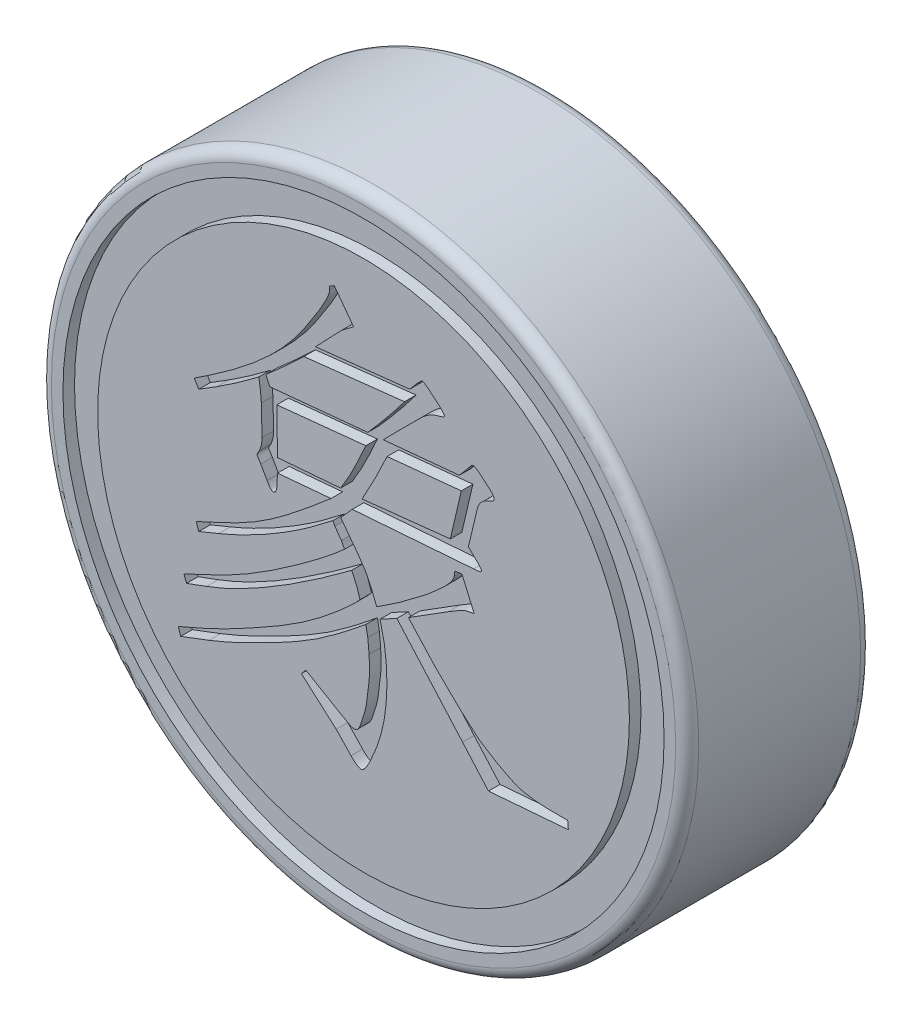
from build123d import *

# Parameters (mm, degrees)
SKETCH_1_R          = 14
EXTRUDE_1_DEPTH     = 8
SKETCH_2_R          = 13
SKETCH_2_R_2        = 11.5
CUT_EXTRUDE_1_DEPTH = 0.5
SKETCH_3_R          = 5.1
CUT_EXTRUDE_2_DEPTH = 5
CHAMFER_1_SIZE      = 0.5
FILLET_1_R          = 0.5
CUT_EXTRUDE_3_DEPTH = 0.5


with BuildPart() as part:
    # 草图1 → 凸台-拉伸1 (new body)
    with BuildSketch(Plane.XY):
        Circle(SKETCH_1_R)
    extrude(amount=EXTRUDE_1_DEPTH)

    # 草图2 → 切除-拉伸1 (cut)
    with BuildSketch(Plane.XY.offset(8)):
        Circle(SKETCH_2_R)
        Circle(SKETCH_2_R_2, mode=Mode.SUBTRACT)
    extrude(amount=-CUT_EXTRUDE_1_DEPTH, mode=Mode.SUBTRACT)

    # 草图3 → 切除-拉伸2 (cut)
    with BuildSketch(Plane(origin=(0, 0, 0), x_dir=(-1, 0, 0), z_dir=(0, 0, -1))):
        Circle(SKETCH_3_R)
    extrude(amount=-CUT_EXTRUDE_2_DEPTH, mode=Mode.SUBTRACT)

    # 倒角1
    chamfer_1_edges = [part.edges().sort_by_distance(p)[0] for p in [
        (5.1, 0, 0),
    ]]
    chamfer(chamfer_1_edges, length=CHAMFER_1_SIZE)

    # 圆角1
    fillet_1_edges = [part.edges().sort_by_distance(p)[0] for p in [
        (-14, 0, 0),
        (-14, 0, 8),
    ]]
    fillet(fillet_1_edges, radius=FILLET_1_R)

    # 草图4 → 切除-拉伸3 (cut)
    with BuildSketch(Plane.XY.offset(8)):
        with BuildLine():
            Line((-8.016001735, -6.294481799), (-6.816555751, -5.770936092))
            add(Edge.make_bspline(
                [(-6.816555751, -5.770936092), (-6.736096721, -5.734272564), (-6.568069029, -5.657705793), (-6.306075082, -5.531549901), (-6.021904447, -5.391596336), (-5.717923238, -5.233122146), (-5.392817068, -5.05979734), (-5.043960847, -4.876368394), (-4.676154732, -4.67222174), (-4.162336316, -4.390514573), (-3.538086661, -4.026858444), (-2.833567998, -3.58349132), (-2.196222333, -3.141384945), (-1.712179228, -2.768855615), (-1.363026845, -2.476579827), (-1.124620619, -2.279498832), (-0.911133713, -2.091940446), (-0.716062928, -1.920559202), (-0.543402091, -1.76164165), (-0.391738773, -1.61592117), (-0.261678193, -1.484464843), (-0.18466558, -1.398188054), (-0.148965724, -1.35819371)],
                knots=[0, 0, 0, 0, 0.659790387, 1.377882082, 2.169829608, 3.02348982, 3.935864268, 4.919166906, 5.964557986, 7.074854972, 9.291896915, 11.354524458, 13.285068997, 15.078124992, 15.910068755, 16.682901149, 17.386195572, 18.030513287, 18.620559245, 19.137110184, 19.60000004, 20, 20, 20, 20], degree=3))
            add(Edge.make_bspline(
                [(-0.148965724, -1.35819371), (-0.197929925, -1.195703318), (-0.293116475, -0.879821524), (-0.440350257, -0.584637043), (-0.51184661, -0.441296203)],
                knots=[0, 0, 0, 0, 1.028805043, 2, 2, 2, 2], degree=3))
            add(Edge.make_bspline(
                [(-0.51184661, -0.441296203), (-0.821778908, -0.670171662), (-1.422660456, -1.113904184), (-2.316867712, -1.730879181), (-3.164298648, -2.290904021), (-3.9704735, -2.789335812), (-4.733111692, -3.227339797), (-5.454140382, -3.605608999), (-6.131367867, -3.925247372), (-6.576416794, -4.098302738), (-6.78885492, -4.180908392)],
                knots=[0, 0, 0, 0, 1.26164123, 2.446008177, 3.557246769, 4.587746726, 5.54939592, 6.436647302, 7.253754593, 8, 8, 8, 8], degree=3))
            Line((-6.78885492, -4.180908392), (-7.653120848, -4.499467948))
            Line((-7.653120848, -4.499467948), (-7.766694256, -4.200298973))
            Line((-7.766694256, -4.200298973), (-6.844256582, -3.768166009))
            add(Edge.make_bspline(
                [(-6.844256582, -3.768166009), (-6.575220907, -3.642371452), (-6.023961317, -3.384615838), (-5.202104785, -2.939579838), (-4.365085719, -2.432409425), (-3.664240634, -1.972463882), (-3.11145262, -1.585615752), (-2.714938999, -1.302300301), (-2.340300035, -1.032039516), (-1.990769703, -0.768186622), (-1.664715102, -0.513166092), (-1.359149318, -0.270592226), (-1.079733002, -0.035425249), (-0.903957691, 0.120667678), (-0.819325834, 0.19582291)],
                knots=[0, 0, 0, 0, 1.477490844, 3.027408892, 4.647371185, 6.345962126, 7.197336506, 8.004328324, 8.770752565, 9.495737239, 10.183166606, 10.830361438, 11.436845353, 12, 12, 12, 12], degree=3))
            add(Edge.make_bspline(
                [(-0.819325834, 0.19582291), (-0.850569669, 0.244803664), (-0.903646772, 0.328012289), (-0.942037827, 0.418846192), (-0.95782999, 0.456210722)],
                knots=[0, 0, 0, 0, 1.177299922, 2, 2, 2, 2], degree=3))
            Line((-0.95782999, 0.456210722), (-1.237608383, 0.849562523))
            Line((-1.237608383, 0.849562523), (-1.320710876, 1.018537592))
            add(Edge.make_bspline(
                [(-1.320710876, 1.018537592), (-1.522988234, 0.861363462), (-1.923185589, 0.550400971), (-2.532970067, 0.107926415), (-3.14937981, -0.299626256), (-3.763391503, -0.688101463), (-4.384359066, -1.040667802), (-5.005565144, -1.368741479), (-5.628737197, -1.669513983), (-6.050344564, -1.848322002), (-6.259769048, -1.937141079)],
                knots=[0, 0, 0, 0, 1.064598699, 2.106264332, 3.130155923, 4.13530034, 5.125350587, 6.096932889, 7.054691928, 8, 8, 8, 8], degree=3))
            Line((-6.259769048, -1.937141079), (-7.124034976, -2.291711716))
            Line((-7.124034976, -2.291711716), (-7.2348383, -1.973152159))
            Line((-7.2348383, -1.973152159), (-6.425974034, -1.59919094))
            add(Edge.make_bspline(
                [(-6.425974034, -1.59919094), (-6.199817015, -1.495732035), (-5.758077095, -1.293651512), (-5.12448287, -0.966930792), (-4.536364915, -0.622546889), (-4.072079288, -0.319551191), (-3.709684134, -0.060318364), (-3.424615192, 0.149394233), (-3.125306343, 0.380427177), (-2.810663421, 0.629123561), (-2.480191066, 0.895002882), (-2.136584694, 1.181349936), (-1.77716961, 1.485969838), (-1.532091584, 1.695280157), (-1.406583452, 1.80247111)],
                knots=[0, 0, 0, 0, 1.46983547, 2.870947828, 4.211348274, 5.496500794, 6.146164825, 6.844762474, 7.58814264, 8.380833691, 9.215279784, 10.095041903, 11.02444239, 12, 12, 12, 12], degree=3))
            Line((-1.406583452, 1.80247111), (-3.719602843, 1.59748496))
            Line((-3.719602843, 1.59748496), (-3.750073757, 1.054548672))
            add(Edge.make_bspline(
                [(-3.750073757, 1.054548672), (-3.755548546, 1.021134342), (-3.765321504, 0.961486956), (-3.791655117, 0.882053583), (-3.832593849, 0.82682244), (-3.888314626, 0.795480261), (-3.957615152, 0.808480854), (-4.024453373, 0.867746884), (-4.098451406, 0.963829032), (-4.14294682, 1.046258046), (-4.168356305, 1.093329836)],
                knots=[0, 0, 0, 0, 1.118842731, 1.997228251, 2.735738812, 3.34969222, 3.996855935, 4.912083638, 6.236619068, 8, 8, 8, 8], degree=3))
            Line((-4.168356305, 1.093329836), (-4.445364616, 1.578094378))
            add(Edge.make_bspline(
                [(-4.445364616, 1.578094378), (-4.467287123, 1.610894769), (-4.505758771, 1.668455936), (-4.547534255, 1.748562196), (-4.582052127, 1.799193518), (-4.602691699, 1.835839463), (-4.602065222, 1.873926159), (-4.577444943, 1.91541338), (-4.548156868, 1.97730787), (-4.518239434, 2.02082337), (-4.500766278, 2.046238423)],
                knots=[0, 0, 0, 0, 1.761816239, 3.091798486, 4.018574667, 4.516891551, 4.929301538, 5.649544618, 6.627225971, 8, 8, 8, 8], degree=3))
            add(Edge.make_bspline(
                [(-4.500766278, 2.046238423), (-4.468456012, 2.131155423), (-4.401929209, 2.305999435), (-4.394027181, 2.492996867), (-4.389962954, 2.589174711)],
                knots=[0, 0, 0, 0, 0.971345828, 2, 2, 2, 2], degree=3))
            Line((-4.389962954, 2.589174711), (-4.417663785, 3.877263354))
            add(Edge.make_bspline(
                [(-4.417663785, 3.877263354), (-4.429375645, 4.028952219), (-4.453096375, 4.336176727), (-4.503134687, 4.640230458), (-4.528467109, 4.79416086)],
                knots=[0, 0, 0, 0, 0.98747894, 2, 2, 2, 2], degree=3))
            add(Edge.make_bspline(
                [(-4.528467109, 4.79416086), (-4.709122295, 4.659836313), (-5.048529206, 4.40747334), (-5.529827981, 4.059683953), (-5.954289182, 3.770316508), (-6.220612161, 3.600602406), (-6.342871541, 3.522692716)],
                knots=[0, 0, 0, 0, 1.218949401, 2.290107802, 3.215049488, 4, 4, 4, 4], degree=3))
            Line((-6.342871541, 3.522692716), (-7.124034976, 3.037928174))
            Line((-7.124034976, 3.037928174), (-7.320710876, 3.353717647))
            Line((-7.320710876, 3.353717647), (-6.594949103, 3.841252273))
            add(Edge.make_bspline(
                [(-6.594949103, 3.841252273), (-6.37595463, 3.991164322), (-5.948928358, 4.283483953), (-5.342621314, 4.736209848), (-4.779573717, 5.183533753), (-4.269551457, 5.636969949), (-3.796829682, 6.0801834), (-3.379882338, 6.531419987), (-3.003203391, 6.975595093), (-2.680436898, 7.417838212), (-2.399617092, 7.836288717), (-2.151236916, 8.214766839), (-1.945940757, 8.553014339), (-1.769886884, 8.842354349), (-1.640502363, 9.094065201), (-1.541419189, 9.298774995), (-1.479935751, 9.463117083), (-1.467218598, 9.560272658), (-1.461985114, 9.600255043)],
                knots=[0, 0, 0, 0, 1.623677782, 3.166075654, 4.629006409, 6.022038805, 7.340773333, 8.591977627, 9.779048191, 10.902259072, 11.939619213, 12.862626529, 13.671728202, 14.360652873, 14.934292475, 15.401894241, 15.753861834, 16, 16, 16, 16], degree=3))
            Line((-1.461985114, 9.600255043), (-1.461985114, 9.730448949))
            Line((-1.461985114, 9.730448949), (-1.265309214, 9.844022356))
            Line((-1.265309214, 9.844022356), (-0.428744117, 8.7221387))
            add(Edge.make_bspline(
                [(-0.428744117, 8.7221387), (-0.492496398, 8.676035747), (-0.606526272, 8.593574167), (-0.759995012, 8.481369912), (-0.8729928, 8.39202042), (-0.952091546, 8.327867426), (-1.011028973, 8.266547306), (-1.082280799, 8.197434691), (-1.176817729, 8.094428458), (-1.302873947, 7.963781488), (-1.457940385, 7.804819191), (-1.636599461, 7.611519127), (-1.849392476, 7.394742596), (-1.996133607, 7.235950433), (-2.07417348, 7.151501581)],
                knots=[0, 0, 0, 0, 1.241809558, 2.221150129, 2.9995588, 3.516447575, 3.825593151, 4.340835778, 5.083071353, 6.031341779, 7.206275743, 8.587741062, 10.185292352, 12, 12, 12, 12], degree=3))
            Line((-2.07417348, 7.151501581), (1.997848681, 7.600255043))
            Line((1.997848681, 7.600255043), (2.333028736, 7.990836761))
            add(Edge.make_bspline(
                [(2.333028736, 7.990836761), (2.35797037, 8.015602687), (2.402778306, 8.060094962), (2.46091522, 8.120033895), (2.507225375, 8.152695177), (2.53913116, 8.185567013), (2.586874203, 8.170128035), (2.646719018, 8.139158082), (2.730610271, 8.071096995), (2.79655941, 8.020105525), (2.834413778, 7.990836761)],
                knots=[0, 0, 0, 0, 1.335143006, 2.398599897, 3.119447549, 3.546264989, 3.971647745, 4.831703707, 6.181418965, 8, 8, 8, 8], degree=3))
            Line((2.834413778, 7.990836761), (3.280397157, 7.616875542))
            add(Edge.make_bspline(
                [(3.280397157, 7.616875542), (3.312956669, 7.58283913), (3.370415398, 7.522774073), (3.44146343, 7.443924109), (3.489811546, 7.386539087), (3.500768941, 7.350331196), (3.504773888, 7.337097149)],
                knots=[0, 0, 0, 0, 1.560479034, 2.753823278, 3.544520234, 4, 4, 4, 4], degree=3))
            add(Edge.make_bspline(
                [(3.504773888, 7.337097149), (3.498041489, 7.326228677), (3.478905029, 7.295335671), (3.407545901, 7.267511195), (3.304299604, 7.231828719), (3.160632405, 7.195011797), (2.993509425, 7.141069077), (2.819817867, 7.045507015), (2.642565277, 6.917652065), (2.530413351, 6.813060831), (2.471532891, 6.75814978)],
                knots=[0, 0, 0, 0, 0.250380672, 0.711692677, 1.451012106, 2.464976545, 3.652565018, 4.945481565, 6.396358775, 8, 8, 8, 8], degree=3))
            Line((2.471532891, 6.75814978), (1.496463639, 5.785850611))
            Line((1.496463639, 5.785850611), (0.853804359, 5.132110999))
            Line((0.853804359, 5.132110999), (4.144663085, 5.447900473))
            Line((4.144663085, 5.447900473), (4.507543972, 5.880033437))
            Line((4.507543972, 5.880033437), (4.676519041, 6.085019586))
            add(Edge.make_bspline(
                [(4.676519041, 6.085019586), (4.696449784, 6.094523825), (4.738663774, 6.114654126), (4.816801608, 6.100855503), (4.898885641, 6.05848869), (4.951585411, 6.015191009), (4.981228182, 5.990836761)],
                knots=[0, 0, 0, 0, 0.760138788, 1.60999979, 2.655663396, 4, 4, 4, 4], degree=3))
            Line((4.981228182, 5.990836761), (5.485383307, 5.56147388))
            add(Edge.make_bspline(
                [(5.485383307, 5.56147388), (5.509775127, 5.53598045), (5.553707533, 5.490063921), (5.606720048, 5.424869587), (5.639376104, 5.372053746), (5.656727735, 5.320196992), (5.644266016, 5.267922666), (5.615916189, 5.225169343), (5.574961806, 5.19701377), (5.522484594, 5.174297043), (5.455829588, 5.135613786), (5.337559427, 5.090114242), (5.190354403, 5.006724893), (5.063481823, 4.884641474), (4.981061516, 4.754454843), (4.931587513, 4.616972794), (4.8818293, 4.446921742), (4.856432052, 4.319824571), (4.842724027, 4.251224572)],
                knots=[0, 0, 0, 0, 0.981383301, 1.767581477, 2.331460262, 2.70542458, 3.254485251, 3.753177836, 4.102517663, 4.619397686, 5.343120874, 6.240223549, 8.138927784, 10.009631161, 11.071408049, 12.397308269, 14.055466959, 16, 16, 16, 16], degree=3))
            Line((4.842724027, 4.251224572), (4.535244803, 2.96313593))
            Line((4.535244803, 2.96313593), (4.981228182, 2.531002966))
            add(Edge.make_bspline(
                [(4.981228182, 2.531002966), (5.009965306, 2.498630099), (5.058150531, 2.444348609), (5.12217094, 2.363606481), (5.088970654, 2.298345151), (5.01258176, 2.28022536), (4.903428417, 2.260842832), (4.812692802, 2.254774147), (4.759621534, 2.251224572)],
                knots=[0, 0, 0, 0, 1.344234119, 2.253956423, 2.622628136, 3.311802141, 4.42767289, 6, 6, 6, 6], degree=3))
            Line((4.759621534, 2.251224572), (-0.484145779, 1.857872772))
            Line((-0.484145779, 1.857872772), (-0.988300904, 1.298315985))
            add(Edge.make_bspline(
                [(-0.988300904, 1.298315985), (-0.910632634, 1.198676439), (-0.762911419, 1.009166941), (-0.554719268, 0.73869878), (-0.373898369, 0.493158572), (-0.217415733, 0.275810948), (-0.082483732, 0.086925161), (0.024776662, -0.074708452), (0.107096395, -0.209618851), (0.18597261, -0.356013915), (0.266723423, -0.53406748), (0.368356225, -0.755372635), (0.469095165, -1.002201574), (0.538114492, -1.174409374), (0.574025966, -1.264010885)],
                knots=[0, 0, 0, 0, 1.506752802, 2.865769457, 4.070577946, 5.143386412, 6.060014213, 6.838876955, 7.456465753, 7.944262149, 8.821129126, 9.787228087, 10.848671735, 12, 12, 12, 12], degree=3))
            Line((0.574025966, -1.264010885), (1.579566132, -0.590880691))
            Line((1.579566132, -0.590880691), (2.723610454, 0.270615154))
            Line((2.723610454, 0.270615154), (3.114192171, 0.60579521))
            add(Edge.make_bspline(
                [(3.114192171, 0.60579521), (3.175351193, 0.660035358), (3.291257857, 0.76282959), (3.451731321, 0.911707561), (3.590093853, 1.047955891), (3.701411075, 1.174062523), (3.793720357, 1.286051708), (3.859764309, 1.387082697), (3.904906142, 1.476265323), (3.917500865, 1.533470438), (3.923056437, 1.558703797)],
                knots=[0, 0, 0, 0, 1.548854708, 2.935340996, 4.147743528, 5.225836105, 6.12206238, 6.893668316, 7.511993558, 8, 8, 8, 8], degree=3))
            Line((3.923056437, 1.558703797), (3.950757268, 1.766460029))
            Line((3.950757268, 1.766460029), (4.258236492, 1.80247111))
            Line((4.258236492, 1.80247111), (4.787322365, 0.586404628))
            add(Edge.make_bspline(
                [(4.787322365, 0.586404628), (4.736618868, 0.576822808), (4.645352574, 0.559575532), (4.521118524, 0.540867398), (4.428950812, 0.51405786), (4.347096772, 0.492338684), (4.254099917, 0.442645082), (4.114776396, 0.363755595), (3.912350594, 0.248107322), (3.758426389, 0.154704279), (3.670978875, 0.101640085)],
                knots=[0, 0, 0, 0, 1.006438987, 1.811590177, 2.444799486, 2.877638462, 3.457403229, 4.489128374, 6.005401442, 8, 8, 8, 8], degree=3))
            Line((3.670978875, 0.101640085), (1.942447019, -0.984232491))
            Line((1.942447019, -0.984232491), (3.08649134, -2.236310054))
            Line((3.08649134, -2.236310054), (4.172363916, -3.302792048))
            Line((4.172363916, -3.302792048), (4.898125689, -3.937141079))
            add(Edge.make_bspline(
                [(4.898125689, -3.937141079), (4.928284455, -3.962474881), (5.001035466, -4.023586787), (5.138490394, -4.118637403), (5.317507145, -4.237016363), (5.618497586, -4.425553804), (6.046713324, -4.662814469), (6.458539884, -4.870878524), (6.770756199, -4.984790014), (6.968389116, -5.033676803), (7.199430522, -5.069900006), (7.461537641, -5.104253596), (7.757455898, -5.12572803), (8.085505256, -5.134341898), (8.447524917, -5.142057553), (8.699603712, -5.136649658), (8.831643695, -5.133816979)],
                knots=[0, 0, 0, 0, 0.391377659, 0.944107601, 1.659487092, 2.525439641, 4.473503117, 6.526417963, 7.101265779, 7.773598047, 8.546223513, 9.425165231, 10.400914677, 11.493841944, 12.687263379, 14, 14, 14, 14], degree=3))
            Line((8.831643695, -5.133816979), (8.859344526, -5.471767117))
            Line((8.859344526, -5.471767117), (5.402280814, -5.751545511))
            Line((5.402280814, -5.751545511), (4.285937323, -4.480077367))
            Line((4.285937323, -4.480077367), (1.441061977, -1.264010885))
            Line((1.441061977, -1.264010885), (0.715300204, -1.657362685))
            add(Edge.make_bspline(
                [(0.715300204, -1.657362685), (0.741974709, -1.763363265), (0.792385747, -1.963689358), (0.851266962, -2.249910817), (0.903987554, -2.501200074), (0.937579818, -2.729852456), (0.964336464, -2.953338379), (0.981852412, -3.190950766), (1.000565821, -3.453054083), (1.008425215, -3.824391887), (1.013628356, -4.276975428), (0.980300682, -4.631637317), (0.964607684, -4.798636923)],
                knots=[0, 0, 0, 0, 1.034667693, 1.955375504, 2.766285696, 3.464803969, 4.142499399, 4.896774328, 5.720169066, 6.629687014, 8.413021083, 10, 10, 10, 10], degree=3))
            add(Edge.make_bspline(
                [(0.964607684, -4.798636923), (0.946916151, -4.957860407), (0.91109602, -5.28024096), (0.807976096, -5.761056711), (0.673704841, -6.246241297), (0.52617254, -6.640958681), (0.401662423, -6.942137133), (0.313878916, -7.139396586), (0.230134104, -7.304917704), (0.15736227, -7.443195851), (0.085223678, -7.548054561), (0.022397365, -7.625179458), (-0.035681151, -7.675428162), (-0.112347047, -7.695820938), (-0.20391532, -7.665392483), (-0.313586293, -7.610504939), (-0.426124521, -7.514452217), (-0.499691313, -7.438255701), (-0.539547441, -7.396974874)],
                knots=[0, 0, 0, 0, 2.08448058, 4.220457865, 6.393492617, 8.633460003, 9.700568779, 10.636752285, 11.443154736, 12.115694166, 12.669188926, 13.095558203, 13.412925353, 13.649103241, 14.092420906, 14.619297936, 15.251979919, 16, 16, 16, 16], degree=3))
            Line((-0.539547441, -7.396974874), (-1.182206721, -6.72384468))
            Line((-1.182206721, -6.72384468), (-2.689131929, -5.396974874))
            Line((-2.689131929, -5.396974874), (-2.492456028, -5.172598142))
            Line((-2.492456028, -5.172598142), (-0.95782999, -6.070105067))
            add(Edge.make_bspline(
                [(-0.95782999, -6.070105067), (-0.882898755, -6.115858453), (-0.750463205, -6.196724261), (-0.567673768, -6.284918322), (-0.428333789, -6.331653195), (-0.313830272, -6.321061582), (-0.238703938, -6.24713569), (-0.17284192, -6.144215887), (-0.112351271, -5.998380501), (-0.053622871, -5.825533438), (0.001018392, -5.649695509), (0.043281796, -5.495579451), (0.079172306, -5.378327458), (0.100602507, -5.283653449), (0.120127194, -5.187773487), (0.138268147, -5.066548585), (0.160781949, -4.907774623), (0.191371351, -4.657431681), (0.231257511, -4.352551676), (0.253689303, -4.059322842), (0.263139396, -3.836535477), (0.257651781, -3.650875912), (0.253669056, -3.43843049), (0.245779856, -3.288003485), (0.241615994, -3.208609223)],
                knots=[0, 0, 0, 0, 1.480074653, 2.61592516, 3.420677286, 3.940590005, 4.449178402, 5.123148717, 6.008856984, 7.097586833, 8.206193717, 9.113420301, 9.79384024, 10.273707314, 10.750276294, 11.444290086, 12.340889734, 13.455717131, 15.698934098, 17.526844129, 18.415287759, 19.459072675, 20.658917327, 22, 22, 22, 22], degree=3))
            add(Edge.make_bspline(
                [(0.241615994, -3.208609223), (0.237634138, -3.140225723), (0.230361604, -3.015328869), (0.211980296, -2.847593052), (0.199981842, -2.716118024), (0.188343752, -2.641629921), (0.183444249, -2.610271272)],
                knots=[0, 0, 0, 0, 1.36657357, 2.495934586, 3.366805486, 4, 4, 4, 4], degree=3))
            Line((0.183444249, -2.610271272), (0.100341756, -2.16151781))
            add(Edge.make_bspline(
                [(0.100341756, -2.16151781), (-0.063913475, -2.293678134), (-0.383889085, -2.551131612), (-0.85363099, -2.925713886), (-1.311045161, -3.26344287), (-1.68201855, -3.532537335), (-1.982370029, -3.740117733), (-2.22642468, -3.89777732), (-2.49162337, -4.059475144), (-2.775113754, -4.230037723), (-3.080094957, -4.404211939), (-3.406500427, -4.583499361), (-3.752762507, -4.769145465), (-4.230256609, -5.018213089), (-4.813908071, -5.315666082), (-5.483940762, -5.632351787), (-6.096508617, -5.910590088), (-6.49099177, -6.069529763), (-6.678051596, -6.144897311)],
                knots=[0, 0, 0, 0, 1.281517215, 2.496445635, 3.651534246, 4.73723058, 5.282120489, 5.870593026, 6.503032029, 7.170088059, 7.881567756, 8.637694216, 9.433701989, 10.269685675, 11.911278333, 13.415102424, 14.774268332, 16, 16, 16, 16], degree=3))
            Line((-6.678051596, -6.144897311), (-7.905198411, -6.610271272))
            Line((-7.905198411, -6.610271272), (-8.016001735, -6.294481799))
        make_face()
        with BuildLine():
            Line((-4.054782898, 4.663966955), (0.183444249, 5.073939254))
            Line((0.183444249, 5.073939254), (0.687599373, 5.655656705))
            Line((0.687599373, 5.655656705), (1.272086908, 6.36479798))
            Line((1.272086908, 6.36479798), (1.773471949, 7.018537592))
            Line((1.773471949, 7.018537592), (-2.578328605, 6.533773049))
            add(Edge.make_bspline(
                [(-2.578328605, 6.533773049), (-2.706575037, 6.413627007), (-2.980244161, 6.157243562), (-3.330050529, 5.833067481), (-3.618829976, 5.562998739), (-3.831513842, 5.37412391), (-4.029658787, 5.198979713), (-4.160702527, 5.090247693), (-4.223757967, 5.037928174)],
                knots=[0, 0, 0, 0, 1.422234495, 3.034951246, 3.859889754, 4.621982204, 5.336927349, 6, 6, 6, 6], degree=3))
            Line((-4.223757967, 5.037928174), (-4.054782898, 4.663966955))
        make_face(mode=Mode.SUBTRACT)
        with BuildLine():
            Line((-3.719602843, 2.176432329), (-0.988300904, 2.40080906))
            add(Edge.make_bspline(
                [(-0.988300904, 2.40080906), (-0.900857709, 2.54302814), (-0.71472863, 2.845751597), (-0.452264303, 3.34745892), (-0.174560363, 3.915287193), (0.005665829, 4.320767336), (0.100341756, 4.533773049)],
                knots=[0, 0, 0, 0, 0.835621593, 1.77868017, 2.833102382, 4, 4, 4, 4], degree=3))
            Line((0.100341756, 4.533773049), (-3.750073757, 4.140421248))
            Line((-3.750073757, 4.140421248), (-3.719602843, 2.176432329))
        make_face(mode=Mode.SUBTRACT)
        with BuildLine():
            Line((3.754081368, 2.868953104), (4.230535661, 4.907734268))
            Line((4.230535661, 4.907734268), (1.020009346, 4.589174711))
            add(Edge.make_bspline(
                [(1.020009346, 4.589174711), (0.942159826, 4.42082414), (0.782673829, 4.075933652), (0.52505612, 3.551261073), (0.238831489, 3.009588558), (0.037178744, 2.643352609), (-0.065863231, 2.456210722)],
                knots=[0, 0, 0, 0, 0.929640286, 1.904502556, 2.929227597, 4, 4, 4, 4], degree=3))
            Line((-0.065863231, 2.456210722), (3.754081368, 2.868953104))
        make_face(mode=Mode.SUBTRACT)
    extrude(amount=-CUT_EXTRUDE_3_DEPTH, mode=Mode.SUBTRACT)


solid = part.part
